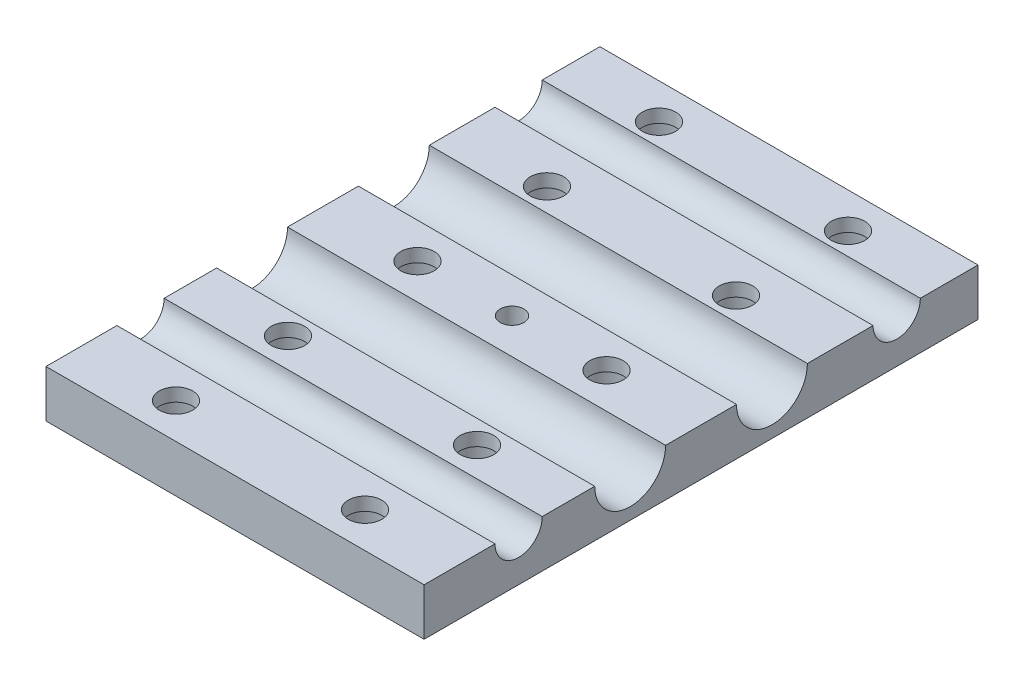
from build123d import *

# Parameters (mm, degrees)
SKETCH1_W             = 74.422
SKETCH1_H             = 50.8
BOSS_EXTRUDE1_DEPTH   = 6.35
SKETCH2_R             = 3.175
CUT_EXTRUDE1_DEPTH    = 64.289975675
SKETCH3_R             = 4.7625
CUT_EXTRUDE2_DEPTH    = 64.289975675
F_8_CLEARANCE_HOLE1_D = 4.4958
SKETCH6_R             = 3.429
CUT_EXTRUDE3_DEPTH    = 4.572
SKETCH7_R             = 1.5875
CUT_EXTRUDE4_DEPTH    = 46.498802413
BODY_MOVE_COPY3_ANGLE = 180


with BuildPart() as part:
    # Sketch1 → Boss-Extrude1 (new body)
    with BuildSketch(Plane(origin=(0, 0, 0), x_dir=(1, 0, 0), z_dir=(0, 1, 0))):
        Rectangle(SKETCH1_W, SKETCH1_H)
    extrude(amount=BOSS_EXTRUDE1_DEPTH)

    # Sketch2 → Cut-Extrude1 (cut, through all)
    with BuildSketch(Plane.XY.offset(25.4)):
        with Locations((-24.511, 0)):
            Circle(SKETCH2_R)
        with Locations((26.289, 0)):
            Circle(SKETCH2_R)
    extrude(amount=-CUT_EXTRUDE1_DEPTH, mode=Mode.SUBTRACT)

    # Sketch3 → Cut-Extrude2 (cut, through all)
    with BuildSketch(Plane.XY.offset(25.4)):
        with Locations((-9.525, 0)):
            Circle(SKETCH3_R)
        with Locations((9.525, 0)):
            Circle(SKETCH3_R)
    extrude(amount=-CUT_EXTRUDE2_DEPTH, mode=Mode.SUBTRACT)

    # #8 Clearance Hole1 (through all)
    with Locations(Plane(origin=(0, 6.35, 0), x_dir=(1, 0, 0), z_dir=(0, 1, 0))):
        with Locations((-32.4485, 12.7), (-32.4485, -12.7), (-17.399, -12.7), (0, -12.7), (17.399, -12.7), (32.4485, -12.7), (32.4485, 12.7), (17.399, 12.7), (0, 12.7), (-17.399, 12.7)):
            Hole(F_8_CLEARANCE_HOLE1_D / 2)

    # Sketch6 → Cut-Extrude3 (cut)
    with BuildSketch(Plane(origin=(0, 6.35, 0), x_dir=(1, 0, 0), z_dir=(0, 1, 0))):
        with Locations(Location((-32.4485, 12.7, 0), (0, 0, 270))):
            Circle(SKETCH6_R)
        with Locations(Location((-17.399, 12.7, 0), (0, 0, 270))):
            Circle(SKETCH6_R)
        with Locations(Location((0, 12.7, 0), (0, 0, 270))):
            Circle(SKETCH6_R)
        with Locations(Location((17.399, 12.7, 0), (0, 0, 270))):
            Circle(SKETCH6_R)
        with Locations(Location((32.4485, 12.7, 0), (0, 0, 270))):
            Circle(SKETCH6_R)
        with Locations(Location((32.4485, -12.7, 0), (0, 0, 270))):
            Circle(SKETCH6_R)
        with Locations(Location((17.399, -12.7, 0), (0, 0, 270))):
            Circle(SKETCH6_R)
        with Locations(Location((0, -12.7, 0), (0, 0, 270))):
            Circle(SKETCH6_R)
        with Locations(Location((-17.399, -12.7, 0), (0, 0, 270))):
            Circle(SKETCH6_R)
        with Locations(Location((-32.4485, -12.7, 0), (0, 0, 270))):
            Circle(SKETCH6_R)
    extrude(amount=-CUT_EXTRUDE3_DEPTH, mode=Mode.SUBTRACT)

    # Sketch7 → Cut-Extrude4 (cut, through all)
    with BuildSketch(Plane(origin=(0, 6.35, 0), x_dir=(1, 0, 0), z_dir=(0, 1, 0))):
        with Locations(Location((0, 0, 0), (0, 0, 270))):
            Circle(SKETCH7_R)
    extrude(amount=-CUT_EXTRUDE4_DEPTH, mode=Mode.SUBTRACT)


with BuildPart() as part_1:
    # Body-Move/Copy3: moved
    add(part.part.moved(Location((0, 0, 0))).rotate(Axis((0, 3.175, 0), (0.7071067811865488, 0, -0.7071067811865462)), BODY_MOVE_COPY3_ANGLE))


solid = part_1.part
